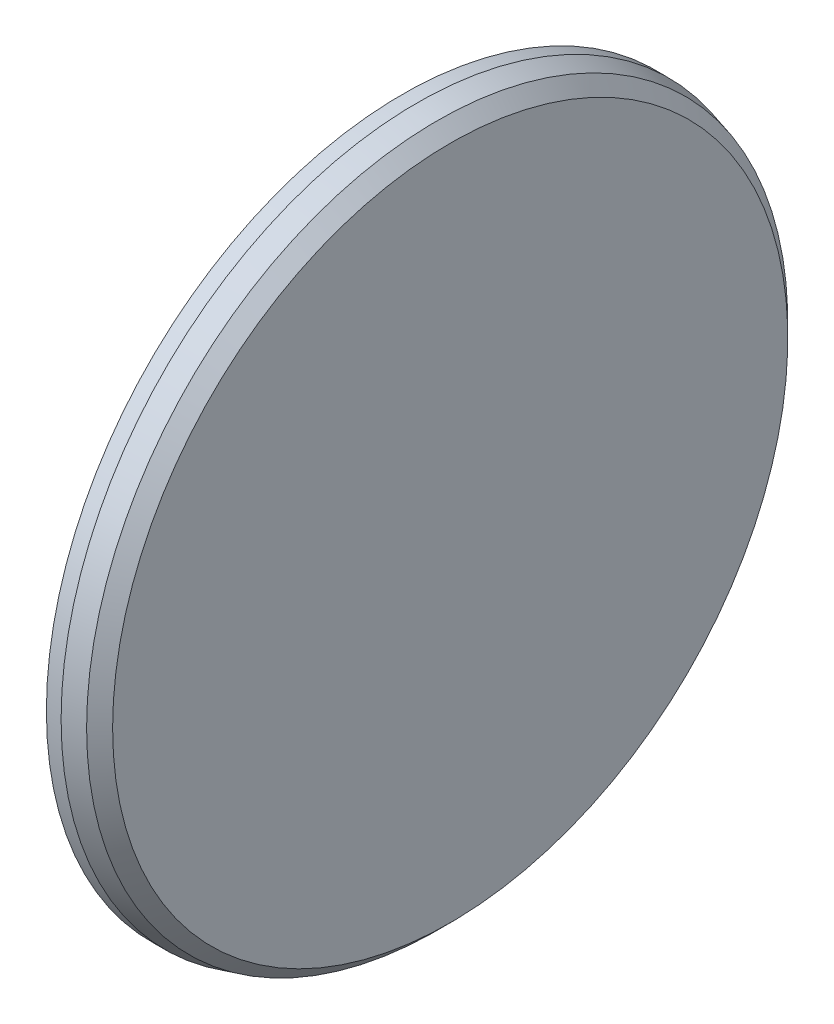
from build123d import *

# Parameters (mm, degrees)
EXTRUDE_1_DEPTH                  = 25
FILLET_3_R                       = 60
FILLET_4_R                       = 10
PATTERN_CIRCULAR_1_COUNT         = 9
FILLET_3_OF_PATTERN_CIRCULAR_1_R = 60
FILLET_4_OF_PATTERN_CIRCULAR_1_R = 10


with BuildPart() as part:
    # 草图1 → 旋转1 (revolve)
    with BuildSketch(Plane.XY, mode=Mode.PRIVATE) as revolve_1_sk:
        Polygon((0, 0), (0, 458.75), (-17.679491924, 476.429491924), (-45, 483.75), (-65, 483.75), (-65, 438.75), (-30, 438.75), (-30, 100), (-85, 100), (-85, 0), align=None)
    revolve(revolve_1_sk.sketch.rotate(Axis((-619.297947583, 0, 0), (1, 0, 0)), 90), axis=Axis((-619.297947583, 0, 0), (1, 0, 0)))

    # 草图3 → 凸台-拉伸1 (add)
    with BuildSketch(Plane.ZY.offset(30)):
        with BuildLine():
            ThreePointArc((20, 438.2939225), (0, 438.75), (-20, 438.2939225))
            Line((-20, 438.2939225), (-20, 97.979589711))
            ThreePointArc((-20, 97.979589711), (0, 100), (20, 97.979589711))
            Line((20, 97.979589711), (20, 438.2939225))
        make_face()
    extrude_1 = extrude(amount=EXTRUDE_1_DEPTH)

    # 圆角3
    fillet_3_edges = [part.edges().sort_by_distance(p)[0] for p in [
        (-42.5, 438.2939225, -20),
    ]]
    fillet(fillet_3_edges, radius=FILLET_3_R)

    # 圆角4
    fillet_4_edges = [part.edges().sort_by_distance(p)[0] for p in [
        (-42.5, 438.2939225, 20),
        (-42.5, 97.979589711, 20),
        (-42.5, 97.979589711, -20),
    ]]
    fillet(fillet_4_edges, radius=FILLET_4_R)

    # 阵列(圆周)1: 凸台-拉伸1 ×9 about axis
    pattern_circular_1_axis = Axis((0, 0, 0), (1, 0, 0))
    for i in range(1, PATTERN_CIRCULAR_1_COUNT):
        add(extrude_1.rotate(pattern_circular_1_axis, i * 360 / PATTERN_CIRCULAR_1_COUNT))

    # 圆角3 of 阵列(圆周)1
    fillet_3_of_pattern_circular_1_edges = [part.edges().sort_by_distance(p)[0] for p in [
        (-42.5, 348.608375977, 266.409013921),
        (-42.5, 95.805095985, 428.162289422),
        (-42.5, -201.826453174, 389.573671209),
        (-42.5, -405.021161842, 168.699202608),
        (-42.5, -418.701967575, -131.111497776),
        (-42.5, -236.467469325, -369.573671209),
        (-42.5, 56.412785864, -435.108216529),
        (-42.5, 322.89687159, -297.050791646),
    ]]
    fillet(fillet_3_of_pattern_circular_1_edges, radius=FILLET_3_OF_PATTERN_CIRCULAR_1_R)

    # 圆角4 of 阵列(圆周)1
    fillet_4_of_pattern_circular_1_edges = [part.edges().sort_by_distance(p)[0] for p in [
        (-42.5, 322.89687159, 297.050791646),
        (-42.5, 62.200968044, 78.300955131),
        (-42.5, 87.912472431, 47.659177406),
        (-42.5, 56.412785864, 435.108216529),
        (-42.5, -2.682177858, 99.964023138),
        (-42.5, 36.710132262, 93.018096031),
        (-42.5, -236.467469325, 369.573671209),
        (-42.5, -66.310302931, 74.852813742),
        (-42.5, -31.66928678, 94.852813742),
        (-42.5, -418.701967575, 131.111497776),
        (-42.5, -98.911100306, 14.7171409),
        (-42.5, -85.230294573, 52.304845732),
        (-42.5, -405.021161842, -168.699202608),
        (-42.5, -85.230294573, -52.304845732),
        (-42.5, -98.911100306, -14.7171409),
        (-42.5, -201.826453174, -389.573671209),
        (-42.5, -31.66928678, -94.852813742),
        (-42.5, -66.310302931, -74.852813742),
        (-42.5, 95.805095985, -428.162289422),
        (-42.5, 36.710132262, -93.018096031),
        (-42.5, -2.682177858, -99.964023138),
        (-42.5, 348.608375977, -266.409013921),
        (-42.5, 87.912472431, -47.659177406),
        (-42.5, 62.200968044, -78.300955131),
    ]]
    fillet(fillet_4_of_pattern_circular_1_edges, radius=FILLET_4_OF_PATTERN_CIRCULAR_1_R)


solid = part.part
